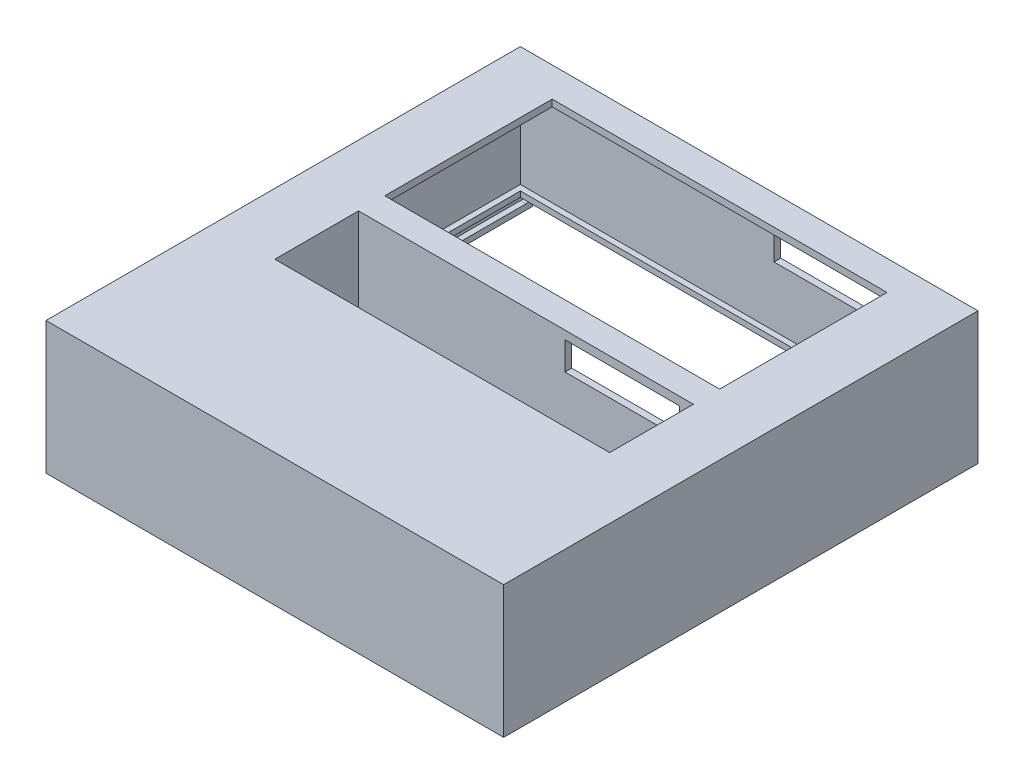
from build123d import *

# Parameters (mm, degrees)
SKETCH1_W            = 82
SKETCH1_H            = 85
BOSS_EXTRUDE1_DEPTH  = 1.2
SKETCH2_W            = 60
SKETCH2_H            = 30
CUT_EXTRUDE1_DEPTH   = 2
SKETCH3_W            = 60
SKETCH3_H            = 15
CUT_EXTRUDE2_DEPTH   = 2
SKETCH4_W            = 82
SKETCH4_H            = 85
SKETCH4_W_2          = 79.6
SKETCH4_H_2          = 82.6
BOSS_EXTRUDE2_DEPTH  = 20
SKETCH5_W            = 62.4
SKETCH5_H            = 17.4
SKETCH5_W_2          = 60
SKETCH5_H_2          = 15
BOSS_EXTRUDE4_DEPTH  = 20
SKETCH10_W           = 1.2
SKETCH10_H           = 3.8
BOSS_EXTRUDE5_DEPTH  = 20
SKETCH11_W           = 5
SKETCH11_H           = 11.2
CUT_EXTRUDE3_DEPTH   = 1.5
SKETCH12_W           = 21.5
SKETCH12_H           = 8
CUT_EXTRUDE4_DEPTH   = 1.5
SKETCH15_W           = 20.5
SKETCH15_H           = 5
CUT_EXTRUDE5_DEPTH   = 1.5
SKETCH16_W           = 79.6
SKETCH16_H           = 1
BOSS_EXTRUDE6_DEPTH  = 1
SKETCH17_W           = 81.6
SKETCH17_H           = 1
BOSS_EXTRUDE7_DEPTH  = 1
SKETCH18_W           = 78.6
SKETCH18_H           = 1
BOSS_EXTRUDE8_DEPTH  = 1
SKETCH19_W           = 80.6
SKETCH19_H           = 1
BOSS_EXTRUDE9_DEPTH  = 1
SKETCH20_W           = 82
SKETCH20_H           = 85
SKETCH20_W_2         = 79.6
SKETCH20_H_2         = 82.6
BOSS_EXTRUDE10_DEPTH = 2.5
SKETCH23_W           = 82.6
SKETCH23_H           = 0.996744569
BOSS_EXTRUDE11_DEPTH = 1
SKETCH25_W           = 78.6
SKETCH25_H           = 0.996744569
BOSS_EXTRUDE13_DEPTH = 1
SKETCH27_W           = 81.6
SKETCH27_H           = 0.996744569
BOSS_EXTRUDE14_DEPTH = 1
CUT_EXTRUDE7_DEPTH   = 1.2


with BuildPart() as part:
    # Sketch1 → Boss-Extrude1 (new body)
    with BuildSketch(Plane(origin=(0, 0, 0), x_dir=(1, 0, 0), z_dir=(0, 1, 0))):
        with Locations((41, 42.5)):
            Rectangle(SKETCH1_W, SKETCH1_H)
    extrude(amount=BOSS_EXTRUDE1_DEPTH)

    # Sketch2 → Cut-Extrude1 (cut)
    with BuildSketch(Plane(origin=(0, 1.2, 0), x_dir=(1, 0, 0), z_dir=(0, 1, 0))):
        with Locations((41, 64.7)):
            Rectangle(SKETCH2_W, SKETCH2_H)
    extrude(amount=-CUT_EXTRUDE1_DEPTH, mode=Mode.SUBTRACT)

    # Sketch3 → Cut-Extrude2 (cut)
    with BuildSketch(Plane(origin=(0, 1.2, 0), x_dir=(1, 0, 0), z_dir=(0, 1, 0))):
        with Locations((41, 37.5)):
            Rectangle(SKETCH3_W, SKETCH3_H)
    extrude(amount=-CUT_EXTRUDE2_DEPTH, mode=Mode.SUBTRACT)

    # Sketch4 → Boss-Extrude2 (add)
    with BuildSketch(Plane.XZ):
        with Locations((41, -42.5)):
            Rectangle(SKETCH4_W, SKETCH4_H)
        with Locations((41, -42.5)):
            Rectangle(SKETCH4_W_2, SKETCH4_H_2, mode=Mode.SUBTRACT)
    extrude(amount=BOSS_EXTRUDE2_DEPTH)

    # Sketch5 → Boss-Extrude4 (add)
    with BuildSketch(Plane.XZ):
        with Locations((41, -37.5)):
            Rectangle(SKETCH5_W, SKETCH5_H)
        with Locations((41, -37.5)):
            Rectangle(SKETCH5_W_2, SKETCH5_H_2, mode=Mode.SUBTRACT)
    extrude(amount=BOSS_EXTRUDE4_DEPTH)

    # Sketch10 → Boss-Extrude5 (add)
    with BuildSketch(Plane.XZ):
        with Locations((9.8, -26.9)):
            Rectangle(SKETCH10_W, SKETCH10_H)
    extrude(amount=BOSS_EXTRUDE5_DEPTH)

    # Sketch11 → Cut-Extrude3 (cut)
    with BuildSketch(Plane.ZY):
        with Locations((-24.5, -9.4)):
            Rectangle(SKETCH11_W, SKETCH11_H)
    extrude(amount=-CUT_EXTRUDE3_DEPTH, mode=Mode.SUBTRACT)

    # Sketch12 → Cut-Extrude4 (cut)
    with BuildSketch(Plane(origin=(0, 0, -85), x_dir=(-1, 0, 0), z_dir=(0, 0, -1))):
        with Locations((-57.4, -4.3)):
            Rectangle(SKETCH12_W, SKETCH12_H)
    extrude(amount=-CUT_EXTRUDE4_DEPTH, mode=Mode.SUBTRACT)

    # Sketch15 → Cut-Extrude5 (cut)
    with BuildSketch(Plane.XY.offset(-45)):
        with Locations((58.25, -2.8)):
            Rectangle(SKETCH15_W, SKETCH15_H)
    extrude(amount=-CUT_EXTRUDE5_DEPTH, mode=Mode.SUBTRACT)

    # Sketch16 → Boss-Extrude6 (add)
    with BuildSketch(Plane.XY.offset(-83.8)):
        with Locations((41, -19.5)):
            Rectangle(SKETCH16_W, SKETCH16_H)
    extrude(amount=BOSS_EXTRUDE6_DEPTH)

    # Sketch17 → Boss-Extrude7 (add)
    with BuildSketch(Plane.ZY.offset(-80.8)):
        with Locations((-42, -19.5)):
            Rectangle(SKETCH17_W, SKETCH17_H)
    extrude(amount=BOSS_EXTRUDE7_DEPTH)

    # Sketch18 → Boss-Extrude8 (add)
    with BuildSketch(Plane(origin=(0, 0, -1.2), x_dir=(-1, 0, 0), z_dir=(0, 0, -1))):
        with Locations((-40.5, -19.5)):
            Rectangle(SKETCH18_W, SKETCH18_H)
    extrude(amount=BOSS_EXTRUDE8_DEPTH)

    # Sketch19 → Boss-Extrude9 (add)
    with BuildSketch(Plane(origin=(1.2, 0, 0), x_dir=(0, 0, -1), z_dir=(1, 0, 0))):
        with Locations((42.5, -19.5)):
            Rectangle(SKETCH19_W, SKETCH19_H)
    extrude(amount=BOSS_EXTRUDE9_DEPTH)

    # Sketch20 → Boss-Extrude10 (add)
    with BuildSketch(Plane.XZ.offset(20)):
        with Locations((41, -42.5)):
            Rectangle(SKETCH20_W, SKETCH20_H)
        with Locations((41, -42.5)):
            Rectangle(SKETCH20_W_2, SKETCH20_H_2, mode=Mode.SUBTRACT)
    extrude(amount=BOSS_EXTRUDE10_DEPTH)

    # Sketch23 → Boss-Extrude11 (add)
    with BuildSketch(Plane.ZY.offset(-80.8)):
        with Locations((-42.5, -22.001627715)):
            Rectangle(SKETCH23_W, SKETCH23_H)
    extrude(amount=BOSS_EXTRUDE11_DEPTH)

    # Sketch25 → Boss-Extrude13 (add)
    with BuildSketch(Plane(origin=(0, 0, -1.2), x_dir=(-1, 0, 0), z_dir=(0, 0, -1))):
        with Locations((-40.5, -22.001627715)):
            Rectangle(SKETCH25_W, SKETCH25_H)
    extrude(amount=BOSS_EXTRUDE13_DEPTH)

    # Sketch27 → Boss-Extrude14 (add)
    with BuildSketch(Plane(origin=(1.2, 0, 0), x_dir=(0, 0, -1), z_dir=(1, 0, 0))):
        with Locations((43, -22.001627715)):
            Rectangle(SKETCH27_W, SKETCH27_H)
    extrude(amount=BOSS_EXTRUDE14_DEPTH)

    # Sketch28 → Cut-Extrude7 (cut)
    with BuildSketch(Plane(origin=(0, 0, -85), x_dir=(-1, 0, 0), z_dir=(0, 0, -1))):
        Polygon((-79.8, -22.5), (-79.8, -21.5), (-80.8, -21.5), (-80.8, -20.2), (-1.2, -20.2), (-1.2, -21.5), (-2.2, -21.5), (-2.2, -22.5), align=None)
    extrude(amount=-CUT_EXTRUDE7_DEPTH, mode=Mode.SUBTRACT)


solid = part.part
